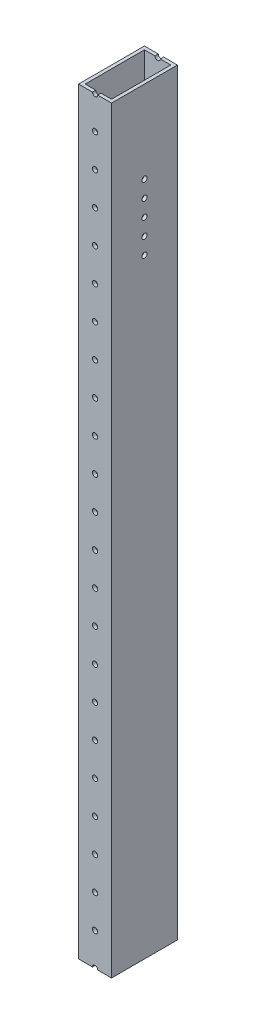
from build123d import *

# Parameters (mm, degrees)
SKETCH1_W           = 25.4
SKETCH1_H           = 50.8
SKETCH1_W_2         = 20.32
SKETCH1_H_2         = 45.72
BOSS_EXTRUDE1_DEPTH = 584.2
SKETCH2_R           = 2.032
CUT_EXTRUDE1_DEPTH  = 587.542044529
SKETCH3_R           = 2.032
CUT_EXTRUDE2_DEPTH  = 586.303305988


with BuildPart() as part:
    # Sketch1 → Boss-Extrude1 (new body)
    with BuildSketch(Plane(origin=(0, 0, 0), x_dir=(1, 0, 0), z_dir=(0, 1, 0))):
        Rectangle(SKETCH1_W, SKETCH1_H)
        Rectangle(SKETCH1_W_2, SKETCH1_H_2, mode=Mode.SUBTRACT)
    extrude(amount=BOSS_EXTRUDE1_DEPTH)

    # Sketch2 → Cut-Extrude1 (cut, through all)
    with BuildSketch(Plane.XY.offset(25.4)):
        Circle(SKETCH2_R)
        with Locations((0, 25.4)):
            Circle(SKETCH2_R)
        with Locations((0, 50.8)):
            Circle(SKETCH2_R)
        with Locations((0, 76.2)):
            Circle(SKETCH2_R)
        with Locations((0, 101.6)):
            Circle(SKETCH2_R)
        with Locations((0, 127)):
            Circle(SKETCH2_R)
        with Locations((0, 152.4)):
            Circle(SKETCH2_R)
        with Locations((0, 177.8)):
            Circle(SKETCH2_R)
        with Locations((0, 203.2)):
            Circle(SKETCH2_R)
        with Locations((0, 228.6)):
            Circle(SKETCH2_R)
        with Locations((0, 254)):
            Circle(SKETCH2_R)
        with Locations((0, 279.4)):
            Circle(SKETCH2_R)
        with Locations((0, 304.8)):
            Circle(SKETCH2_R)
        with Locations((0, 330.2)):
            Circle(SKETCH2_R)
        with Locations((0, 355.6)):
            Circle(SKETCH2_R)
        with Locations((0, 381)):
            Circle(SKETCH2_R)
        with Locations((0, 406.4)):
            Circle(SKETCH2_R)
        with Locations((0, 431.8)):
            Circle(SKETCH2_R)
        with Locations((0, 457.2)):
            Circle(SKETCH2_R)
        with Locations((0, 482.6)):
            Circle(SKETCH2_R)
        with Locations((0, 508)):
            Circle(SKETCH2_R)
        with Locations((0, 533.4)):
            Circle(SKETCH2_R)
        with Locations((0, 558.8)):
            Circle(SKETCH2_R)
        with Locations((0, 584.2)):
            Circle(SKETCH2_R)
    extrude(amount=-CUT_EXTRUDE1_DEPTH, mode=Mode.SUBTRACT)

    # Sketch3 → Cut-Extrude2 (cut, through all)
    with BuildSketch(Plane.ZY.offset(12.7)):
        with Locations((0, 520.7)):
            Circle(SKETCH3_R)
        with Locations((0, 508)):
            Circle(SKETCH3_R)
        with Locations((0, 495.3)):
            Circle(SKETCH3_R)
        with Locations((0, 482.6)):
            Circle(SKETCH3_R)
        with Locations((0, 469.9)):
            Circle(SKETCH3_R)
    extrude(amount=-CUT_EXTRUDE2_DEPTH, mode=Mode.SUBTRACT)


solid = part.part
